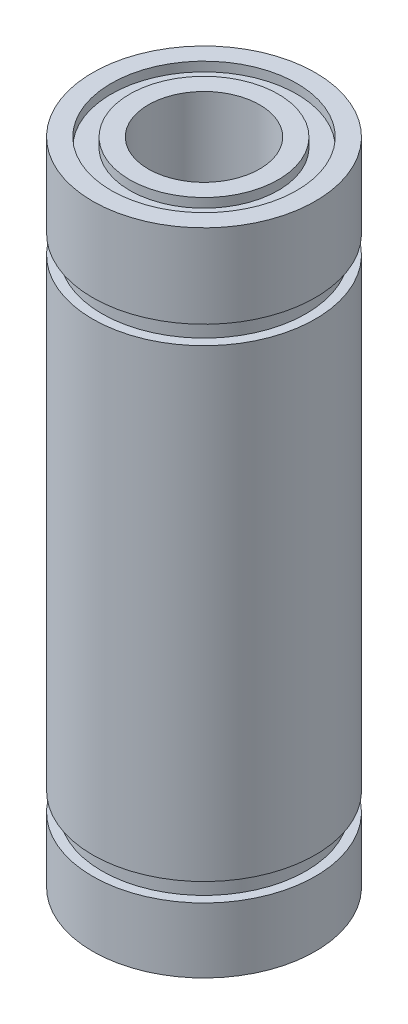
from build123d import *

# Parameters (mm, degrees)
SKETCH_1_R          = 6000
SKETCH_1_R_2        = 5000
EXTRUDE_1_DEPTH     = 17500
SKETCH_1_5_R        = 4000
SKETCH_1_5_R_2      = 3000
EXTRUDE_3_DEPTH     = 17500
SKETCH_1_6_R        = 5000
SKETCH_1_6_R_2      = 4000
EXTRUDE_4_DEPTH     = 17000
SKETCH_5_R          = 6000
SKETCH_5_R_2        = 5500
CUT_EXTRUDE_4_DEPTH = 1000
SKETCH_6_R          = 6000
SKETCH_6_R_2        = 5500
CUT_EXTRUDE_5_DEPTH = 1000


with BuildPart() as part:
    # 草圖1 → 填料-伸長1 (new, symmetric)
    with BuildSketch(Plane(origin=(0, 0, 0), x_dir=(1, 0, 0), z_dir=(0, 1, 0))):
        Circle(SKETCH_1_R)
        Circle(SKETCH_1_R_2, mode=Mode.SUBTRACT)
    extrude(amount=EXTRUDE_1_DEPTH, both=True)



with BuildPart() as body_2:
    # 草圖1<5> → 填料-伸長3 (new, symmetric)
    with BuildSketch(Plane(origin=(0, 0, 0), x_dir=(1, 0, 0), z_dir=(0, 1, 0))):
        Circle(SKETCH_1_5_R)
        Circle(SKETCH_1_5_R_2, mode=Mode.SUBTRACT)
    extrude(amount=EXTRUDE_3_DEPTH, both=True)


with BuildPart() as part_1:
    add(part.part)

    add(body_2.part)  # 填料-伸長4 merges body 2
    # 草圖1<6> → 填料-伸長4 (add, symmetric)
    with BuildSketch(Plane(origin=(0, 0, 0), x_dir=(1, 0, 0), z_dir=(0, 1, 0))):
        Circle(SKETCH_1_6_R)
        Circle(SKETCH_1_6_R_2, mode=Mode.SUBTRACT)
    extrude(amount=EXTRUDE_4_DEPTH, both=True)

    # 草圖5 → 除料-伸長4 (cut)
    with BuildSketch(Plane(origin=(0, 13000, 0), x_dir=(1, 0, 0), z_dir=(0, 1, 0))):
        Circle(SKETCH_5_R)
        Circle(SKETCH_5_R_2, mode=Mode.SUBTRACT)
    extrude(amount=-CUT_EXTRUDE_4_DEPTH, mode=Mode.SUBTRACT)

    # 草圖6 → 除料-伸長5 (cut)
    with BuildSketch(Plane(origin=(0, -13000, 0), x_dir=(1, 0, 0), z_dir=(0, 1, 0))):
        Circle(SKETCH_6_R)
        Circle(SKETCH_6_R_2, mode=Mode.SUBTRACT)
    extrude(amount=-CUT_EXTRUDE_5_DEPTH, mode=Mode.SUBTRACT)


solid = part_1.part
